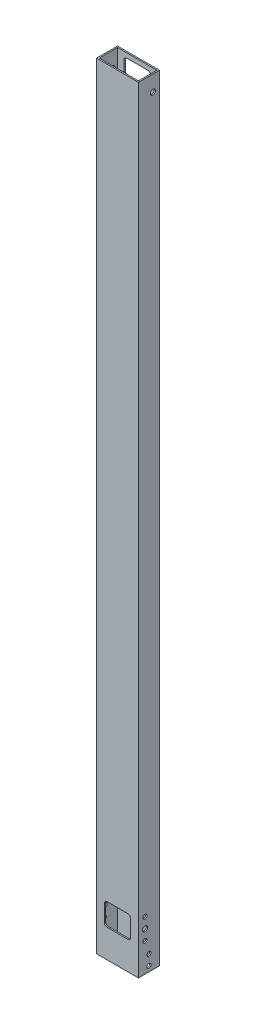
from build123d import *

# Parameters (mm, degrees)
SKETCH1_W               = 50.8
SKETCH1_H               = 939.8
BOSS_EXTRUDE1_DEPTH     = 12.7
SHELL1_T                = -1.5875
CUT_EXTRUDE1_DEPTH      = 471.757326018
CUT_EXTRUDE1_DEPTH_BACK = 471.757326018
SKETCH3_R               = 2.4892
CUT_EXTRUDE2_DEPTH      = 471.757326018
CUT_EXTRUDE2_DEPTH_BACK = 471.757326018
SKETCH4_R               = 3.175
SKETCH4_R_2             = 2.4892
SKETCH5_W               = 31.75
SKETCH5_H               = 26.9875
CUT_EXTRUDE3_DEPTH      = 471.757326018
FILLET1_R               = 3.175
CUT_EXTRUDE4_DEPTH      = 471.757326018
CUT_EXTRUDE4_DEPTH_BACK = 471.757326018
SKETCH6_R               = 3.175
SKETCH7_W               = 31.75
SKETCH7_H               = 26.9875
CUT_EXTRUDE5_DEPTH      = 471.757326018
FILLET2_R               = 3.175


with BuildPart() as part:
    # Sketch1 → Boss-Extrude1 (new, symmetric)
    with BuildSketch(Plane.XY):
        Rectangle(SKETCH1_W, SKETCH1_H)
    extrude(amount=BOSS_EXTRUDE1_DEPTH, both=True)

    # Shell1
    shell1_openings = [part.faces().sort_by_distance(p)[0] for p in [
        (0, -469.9, 0),
        (0, 469.9, 0),
    ]]
    offset(amount=SHELL1_T, openings=shell1_openings, kind=Kind.INTERSECTION)

    # Sketch3 → Cut-Extrude1 (cut, two sides: drawn at the far end of the back side and taken through both)
    with BuildSketch(Plane(origin=(0, 0, 0), x_dir=(0, 0, -1), z_dir=(1, 0, 0)).offset(-CUT_EXTRUDE1_DEPTH_BACK)):
        with Locations((0, -463.55)):
            Circle(SKETCH3_R)
        with Locations((0, -450.85)):
            Circle(SKETCH3_R)
    extrude(amount=CUT_EXTRUDE1_DEPTH + CUT_EXTRUDE1_DEPTH_BACK, mode=Mode.SUBTRACT)

    # Sketch4 → Cut-Extrude2 (cut, two sides: drawn at the far end of the back side and taken through both)
    with BuildSketch(Plane(origin=(0, 0, 0), x_dir=(0, 0, -1), z_dir=(1, 0, 0)).offset(-CUT_EXTRUDE2_DEPTH_BACK)):
        with Locations((-4.7625, -422.275)):
            Circle(SKETCH4_R)
        with Locations((-4.7625, -409.575)):
            Circle(SKETCH4_R_2)
        with Locations((-4.7625, -434.975)):
            Circle(SKETCH4_R_2)
    extrude(amount=CUT_EXTRUDE2_DEPTH + CUT_EXTRUDE2_DEPTH_BACK, mode=Mode.SUBTRACT)

    # Sketch5 → Cut-Extrude3 (cut, through all)
    with BuildSketch(Plane.XY):
        with Locations((0, -422.275)):
            Rectangle(SKETCH5_W, SKETCH5_H)
    extrude(amount=CUT_EXTRUDE3_DEPTH, mode=Mode.SUBTRACT)

    # Fillet1
    fillet1_edges = [part.edges().sort_by_distance(p)[0] for p in [
        (-15.875, -408.78125, 11.90625),
        (-15.875, -435.76875, 11.90625),
        (15.875, -435.76875, 11.90625),
        (15.875, -408.78125, 11.90625),
    ]]
    fillet(fillet1_edges, radius=FILLET1_R)

    # Sketch6 → Cut-Extrude4 (cut, two sides: drawn at the far end of the back side and taken through both)
    with BuildSketch(Plane(origin=(0, 0, 0), x_dir=(0, 0, -1), z_dir=(1, 0, 0)).offset(-CUT_EXTRUDE4_DEPTH_BACK)):
        with Locations((4.7625, 450.85)):
            Circle(SKETCH6_R)
    extrude(amount=CUT_EXTRUDE4_DEPTH + CUT_EXTRUDE4_DEPTH_BACK, mode=Mode.SUBTRACT)

    # Sketch7 → Cut-Extrude5 (cut, through all)
    with BuildSketch(Plane.XY):
        with Locations((0, 450.85)):
            Rectangle(SKETCH7_W, SKETCH7_H)
    extrude(amount=-CUT_EXTRUDE5_DEPTH, mode=Mode.SUBTRACT)

    # Fillet2
    fillet2_edges = [part.edges().sort_by_distance(p)[0] for p in [
        (15.875, 464.34375, -11.90625),
        (15.875, 437.35625, -11.90625),
        (-15.875, 437.35625, -11.90625),
        (-15.875, 464.34375, -11.90625),
    ]]
    fillet(fillet2_edges, radius=FILLET2_R)


solid = part.part
